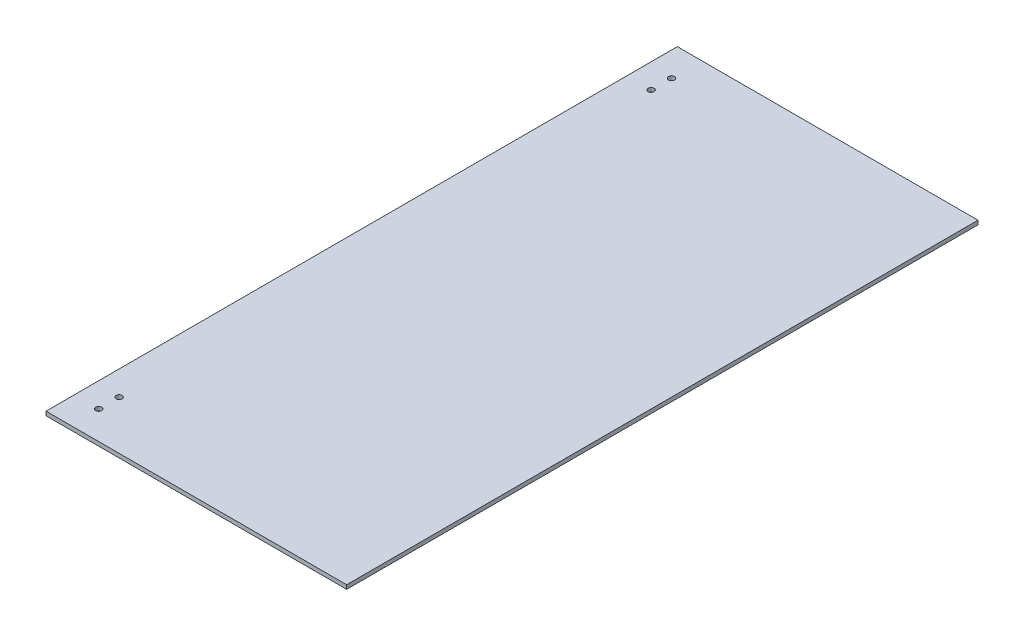
from build123d import *

# Parameters (mm, degrees)
SKETCH1_W           = 150
SKETCH1_H           = 315
BOSS_EXTRUDE1_DEPTH = 2
SKETCH2_R           = 1.5
CUT_EXTRUDE1_DEPTH  = 175.457014763


with BuildPart() as part:
    # Sketch1 → Boss-Extrude1 (new body)
    with BuildSketch(Plane(origin=(0, 0, 0), x_dir=(1, 0, 0), z_dir=(0, 1, 0))):
        Rectangle(SKETCH1_W, SKETCH1_H)
    extrude(amount=BOSS_EXTRUDE1_DEPTH)

    # Sketch2 → Cut-Extrude1 (cut, through all)
    with BuildSketch(Plane(origin=(0, 2, 0), x_dir=(1, 0, 0), z_dir=(0, 1, 0))):
        with Locations(Location((-62.827286594, -143.37855393, 0), (0, 0, 270))):
            Circle(SKETCH2_R)
        with Locations(Location((-62.827286594, -133.206048982, 0), (0, 0, 270))):
            Circle(SKETCH2_R)
        with Locations(Location((-62.827286594, 132.2325662, 0), (0, 0, 270))):
            Circle(SKETCH2_R)
        with Locations(Location((-62.827286594, 142.405071148, 0), (0, 0, 270))):
            Circle(SKETCH2_R)
    extrude(amount=-CUT_EXTRUDE1_DEPTH, mode=Mode.SUBTRACT)


solid = part.part
